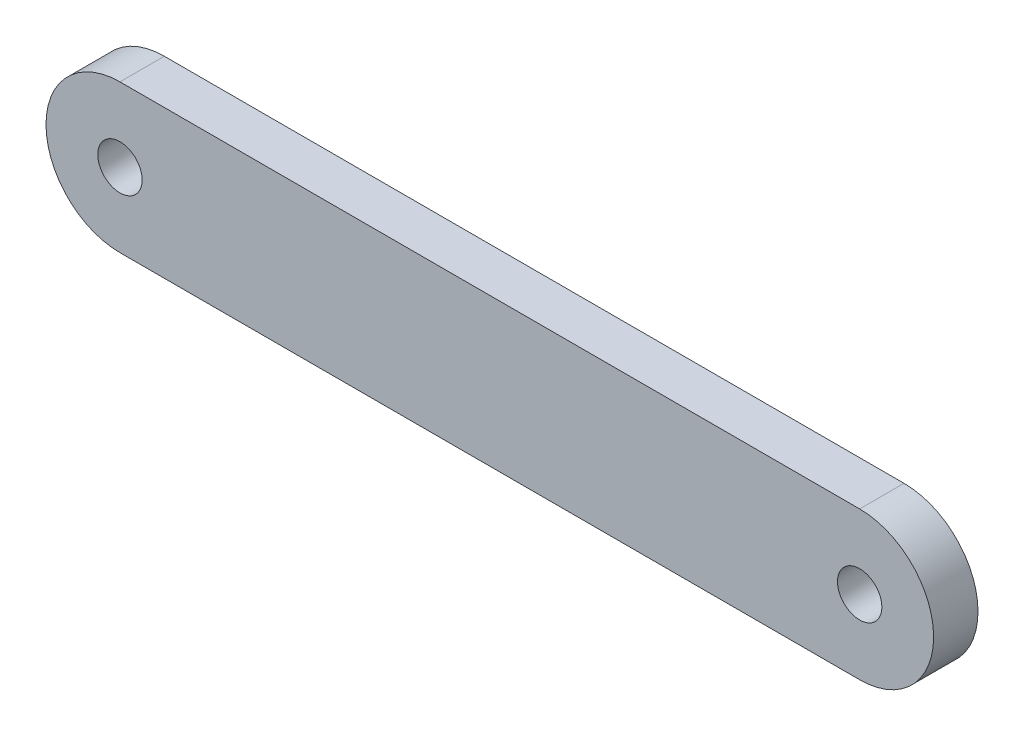
from build123d import *

# Parameters (mm, degrees)
SKETCH1_R           = 1.5
BOSS_EXTRUDE1_DEPTH = 3


with BuildPart() as part:
    # Sketch1 → Boss-Extrude1 (new body)
    with BuildSketch(Plane.XY):
        with BuildLine():
            Line((0, 5), (50, 5))
            ThreePointArc((50, 5), (55, 0), (50, -5))
            Line((50, -5), (0, -5))
            ThreePointArc((0, -5), (-5, 0), (0, 5))
        make_face()
        Circle(SKETCH1_R, mode=Mode.SUBTRACT)
        with Locations((50, 0)):
            Circle(SKETCH1_R, mode=Mode.SUBTRACT)
    extrude(amount=BOSS_EXTRUDE1_DEPTH)


solid = part.part
